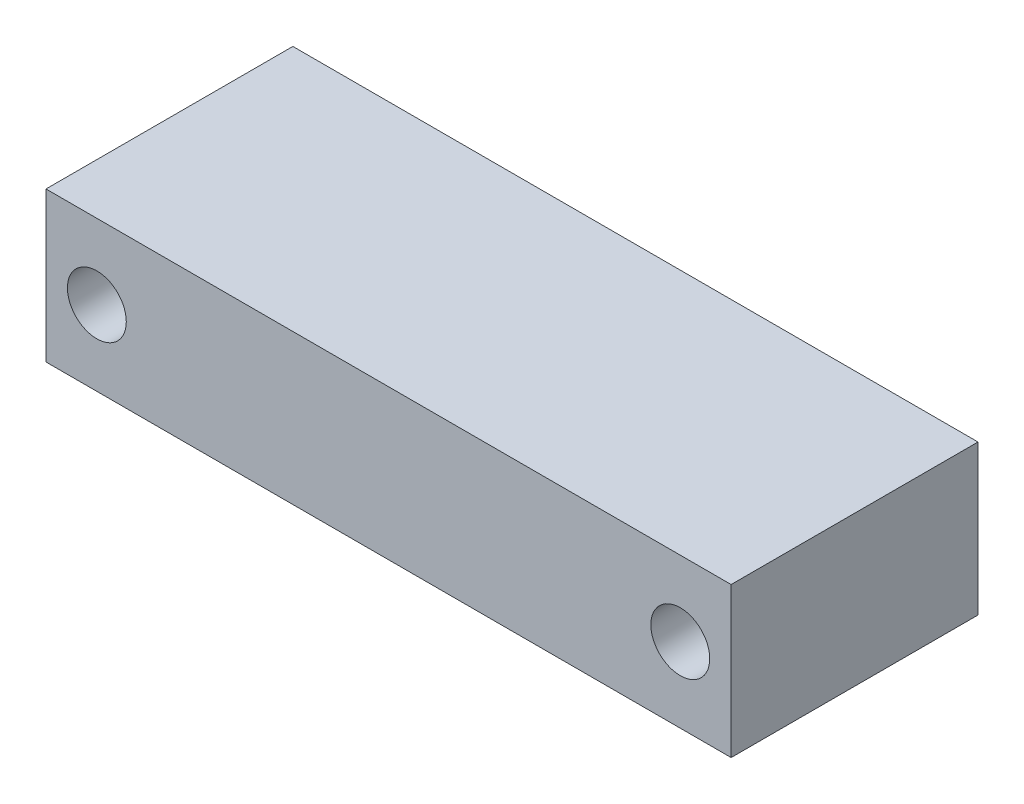
from build123d import *

# Parameters (mm, degrees)
SKETCH_1_W      = 64
SKETCH_1_H      = 14
SKETCH_1_R      = 2.75
EXTRUDE_1_DEPTH = 23.06


with BuildPart() as part:
    # 草图1 → 凸台-拉伸1 (new body)
    with BuildSketch(Plane.XY):
        Rectangle(SKETCH_1_W, SKETCH_1_H)
        with Locations((-27.25, 0)):
            Circle(SKETCH_1_R, mode=Mode.SUBTRACT)
        with Locations((27.25, 0)):
            Circle(SKETCH_1_R, mode=Mode.SUBTRACT)
    extrude(amount=EXTRUDE_1_DEPTH)


solid = part.part
